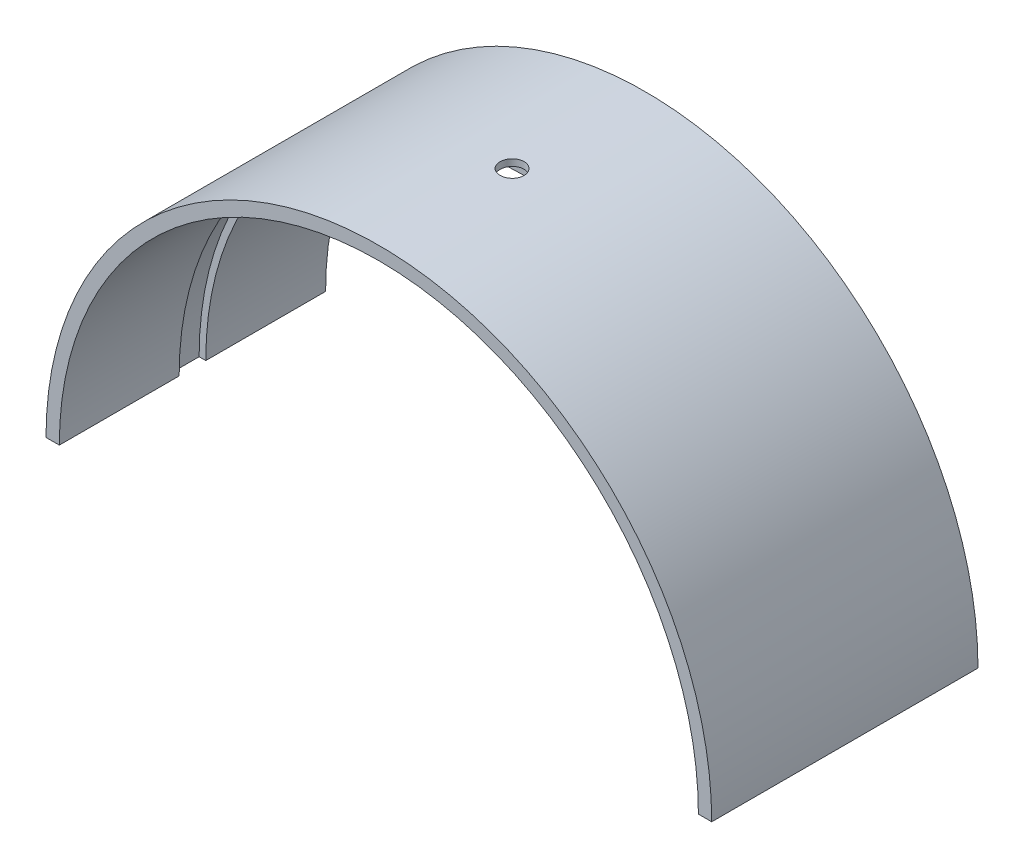
from build123d import *

# Parameters (mm, degrees)
BOSS_EXTRUDE1_DEPTH = 20
SKETCH5_W           = 0.5
SKETCH5_H           = 2
SKETCH8_R           = 0.9
CUT_EXTRUDE1_DEPTH  = 41.620192023


with BuildPart() as part:
    # Sketch1 → Boss-Extrude1 (new body)
    with BuildSketch(Plane.XY):
        with BuildLine():
            Line((24, 0), (25, 0))
            ThreePointArc((25, 0), (0, 25), (-25, 0))
            Line((-25, 0), (-24, 0))
            ThreePointArc((-24, 0), (0, 24), (24, 0))
        make_face()
    extrude(amount=BOSS_EXTRUDE1_DEPTH)

    # Sketch5 → Cut-Revolve2 (revolve, cut)
    with BuildSketch(Plane(origin=(0, 0, 0), x_dir=(-1, 0, 0), z_dir=(0, -1, 0))):
        with Locations((24.25, -10)):
            Rectangle(SKETCH5_W, SKETCH5_H)
    revolve(axis=Axis((0, 0, 0), (0, 0, 1)), mode=Mode.SUBTRACT)

    # Sketch8 → Cut-Extrude1 (cut, through all)
    with BuildSketch(Plane.XZ):
        with Locations(Location((0, 10, 0), (0, 0, 270))):
            Circle(SKETCH8_R)
    extrude(amount=-CUT_EXTRUDE1_DEPTH, mode=Mode.SUBTRACT)


solid = part.part
